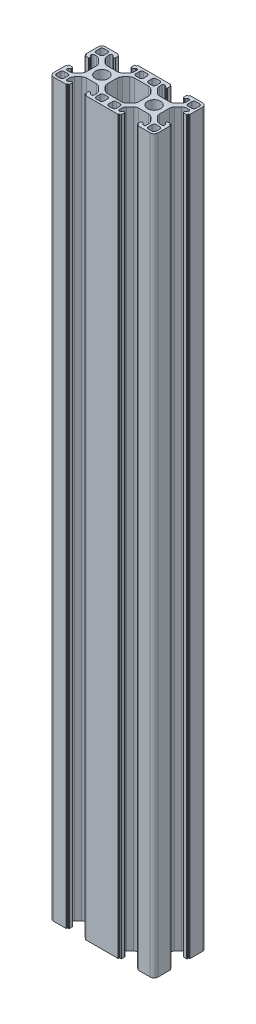
from build123d import *

# Parameters (mm, degrees)
EXTRUDE_1_DEPTH = 280


with BuildPart() as part:
    # Эскиз1 → Бобышка-Вытянуть1 (new body)
    with BuildSketch(Plane(origin=(0, 0, 0), x_dir=(1, 0, 0), z_dir=(0, 1, 0))):
        with BuildLine():
            Line((9.247825015, 4.683728486), (11.146605684, 4.683728486))
            ThreePointArc((11.146605684, 4.683728486), (11.911972549, 4.835969421), (12.560819246, 5.269514923))
            Line((12.560819246, 5.269514923), (13.862038577, 6.570734254))
            ThreePointArc((13.862038577, 6.570734254), (14.29558408, 7.219580952), (14.447825015, 7.984947817))
            Line((14.447825015, 7.984947817), (14.447825015, 8.883728486))
            ThreePointArc((14.447825015, 8.883728486), (14.301378405, 9.237281876), (13.947825015, 9.383728486))
            Line((13.947825015, 9.383728486), (13.844931796, 9.383728486))
            ThreePointArc((13.844931796, 9.383728486), (13.65359008, 9.345668252), (13.491378405, 9.237281876))
            Line((13.491378405, 9.237281876), (13.01104832, 8.75695179))
            ThreePointArc((13.01104832, 8.75695179), (12.929942482, 8.702758603), (12.834271624, 8.683728486))
            Line((12.834271624, 8.683728486), (12.547825015, 8.683728486))
            ThreePointArc((12.547825015, 8.683728486), (12.37104832, 8.75695179), (12.297825015, 8.933728486))
            Line((12.297825015, 8.933728486), (12.297825015, 10.082799306))
            ThreePointArc((12.297825015, 10.082799306), (12.341758998, 10.188865323), (12.447825015, 10.232799306))
            Line((12.447825015, 10.232799306), (12.947825015, 10.232799306))
            Line((12.947825015, 10.232799306), (12.947825015, 10.533728486))
            ThreePointArc((12.947825015, 10.533728486), (12.991758998, 10.639794503), (13.097825015, 10.683728486))
            Line((13.097825015, 10.683728486), (17.747825015, 10.683728486))
            ThreePointArc((17.747825015, 10.683728486), (18.808485187, 10.244388658), (19.247825015, 9.183728486))
            Line((19.247825015, 9.183728486), (19.247825015, 4.533728486))
            ThreePointArc((19.247825015, 4.533728486), (19.203891032, 4.427662469), (19.097825015, 4.383728486))
            Line((19.097825015, 4.383728486), (18.796895835, 4.383728486))
            Line((18.796895835, 4.383728486), (18.796895835, 3.883728486))
            ThreePointArc((18.796895835, 3.883728486), (18.752961853, 3.777662469), (18.646895835, 3.733728486))
            Line((18.646895835, 3.733728486), (17.497825015, 3.733728486))
            ThreePointArc((17.497825015, 3.733728486), (17.32104832, 3.80695179), (17.247825015, 3.983728486))
            Line((17.247825015, 3.983728486), (17.247825015, 4.270175095))
            ThreePointArc((17.247825015, 4.270175095), (17.266855132, 4.365845953), (17.32104832, 4.44695179))
            Line((17.32104832, 4.44695179), (17.801378405, 4.927281876))
            ThreePointArc((17.801378405, 4.927281876), (17.909764781, 5.089493551), (17.947825015, 5.280835267))
            Line((17.947825015, 5.280835267), (17.947825015, 5.383728486))
            ThreePointArc((17.947825015, 5.383728486), (17.801378405, 5.737281876), (17.447825015, 5.883728486))
            Line((17.447825015, 5.883728486), (16.549044346, 5.883728486))
            ThreePointArc((16.549044346, 5.883728486), (15.783677481, 5.731487551), (15.134830783, 5.297942048))
            Line((15.134830783, 5.297942048), (13.833611452, 3.996722717))
            ThreePointArc((13.833611452, 3.996722717), (13.40006595, 3.34787602), (13.247825015, 2.582509155))
            Line((13.247825015, 2.582509155), (13.247825015, 0.683728486))
            Line((13.247825015, 0.683728486), (13.247825015, -1.215052183))
            ThreePointArc((13.247825015, -1.215052183), (13.40006595, -1.980419048), (13.833611452, -2.629265746))
            Line((13.833611452, -2.629265746), (15.134830783, -3.930485077))
            ThreePointArc((15.134830783, -3.930485077), (15.783677481, -4.364030579), (16.549044346, -4.516271514))
            Line((16.549044346, -4.516271514), (17.447825015, -4.516271514))
            ThreePointArc((17.447825015, -4.516271514), (17.801378405, -4.369824905), (17.947825015, -4.016271514))
            Line((17.947825015, -4.016271514), (17.947825015, -3.913378295))
            ThreePointArc((17.947825015, -3.913378295), (17.909764781, -3.722036579), (17.801378405, -3.559824905))
            Line((17.801378405, -3.559824905), (17.32104832, -3.079494819))
            ThreePointArc((17.32104832, -3.079494819), (17.266855132, -2.998388982), (17.247825015, -2.902718124))
            Line((17.247825015, -2.902718124), (17.247825015, -2.616271514))
            ThreePointArc((17.247825015, -2.616271514), (17.32104832, -2.439494819), (17.497825015, -2.366271514))
            Line((17.497825015, -2.366271514), (18.646895835, -2.366271514))
            ThreePointArc((18.646895835, -2.366271514), (18.752961853, -2.410205497), (18.796895835, -2.516271514))
            Line((18.796895835, -2.516271514), (18.796895835, -3.016271514))
            Line((18.796895835, -3.016271514), (19.097825015, -3.016271514))
            ThreePointArc((19.097825015, -3.016271514), (19.203891032, -3.060205497), (19.247825015, -3.166271514))
            Line((19.247825015, -3.166271514), (19.247825015, -7.816271514))
            ThreePointArc((19.247825015, -7.816271514), (18.808485187, -8.876931686), (17.747825015, -9.316271514))
            Line((17.747825015, -9.316271514), (13.097825015, -9.316271514))
            ThreePointArc((13.097825015, -9.316271514), (12.991758998, -9.272337531), (12.947825015, -9.166271514))
            Line((12.947825015, -9.166271514), (12.947825015, -8.865342335))
            Line((12.947825015, -8.865342335), (12.447825015, -8.865342335))
            ThreePointArc((12.447825015, -8.865342335), (12.341758998, -8.821408352), (12.297825015, -8.715342335))
            Line((12.297825015, -8.715342335), (12.297825015, -7.566271514))
            ThreePointArc((12.297825015, -7.566271514), (12.37104832, -7.389494819), (12.547825015, -7.316271514))
            Line((12.547825015, -7.316271514), (12.834271624, -7.316271514))
            ThreePointArc((12.834271624, -7.316271514), (12.929942482, -7.335301631), (13.01104832, -7.389494819))
            Line((13.01104832, -7.389494819), (13.491378405, -7.869824905))
            ThreePointArc((13.491378405, -7.869824905), (13.65359008, -7.978211281), (13.844931796, -8.016271514))
            Line((13.844931796, -8.016271514), (13.947825015, -8.016271514))
            ThreePointArc((13.947825015, -8.016271514), (14.301378405, -7.869824905), (14.447825015, -7.516271514))
            Line((14.447825015, -7.516271514), (14.447825015, -6.617490845))
            ThreePointArc((14.447825015, -6.617490845), (14.29558408, -5.85212398), (13.862038577, -5.203277283))
            Line((13.862038577, -5.203277283), (12.560819246, -3.902057952))
            ThreePointArc((12.560819246, -3.902057952), (11.911972549, -3.468512449), (11.146605684, -3.316271514))
            Line((11.146605684, -3.316271514), (9.247825015, -3.316271514))
            Line((9.247825015, -3.316271514), (7.349044346, -3.316271514))
            ThreePointArc((7.349044346, -3.316271514), (6.583677481, -3.468512449), (5.934830783, -3.902057952))
            Line((5.934830783, -3.902057952), (4.633611452, -5.203277283))
            ThreePointArc((4.633611452, -5.203277283), (4.20006595, -5.85212398), (4.047825015, -6.617490845))
            Line((4.047825015, -6.617490845), (4.047825015, -7.516271514))
            ThreePointArc((4.047825015, -7.516271514), (4.194271624, -7.869824905), (4.547825015, -8.016271514))
            Line((4.547825015, -8.016271514), (4.650718234, -8.016271514))
            ThreePointArc((4.650718234, -8.016271514), (4.84205995, -7.978211281), (5.004271624, -7.869824905))
            Line((5.004271624, -7.869824905), (5.48460171, -7.389494819))
            ThreePointArc((5.48460171, -7.389494819), (5.565707547, -7.335301631), (5.661378405, -7.316271514))
            Line((5.661378405, -7.316271514), (5.947825015, -7.316271514))
            ThreePointArc((5.947825015, -7.316271514), (6.12460171, -7.389494819), (6.197825015, -7.566271514))
            Line((6.197825015, -7.566271514), (6.197825015, -8.715342335))
            ThreePointArc((6.197825015, -8.715342335), (6.153891032, -8.821408352), (6.047825015, -8.865342335))
            Line((6.047825015, -8.865342335), (5.547825015, -8.865342335))
            Line((5.547825015, -8.865342335), (5.547825015, -9.166271514))
            ThreePointArc((5.547825015, -9.166271514), (5.503891032, -9.272337531), (5.397825015, -9.316271514))
            Line((5.397825015, -9.316271514), (0.747825015, -9.316271514))
            Line((0.747825015, -9.316271514), (-2.252174985, -9.316271514))
            Line((-2.252174985, -9.316271514), (-6.902174985, -9.316271514))
            ThreePointArc((-6.902174985, -9.316271514), (-7.008241002, -9.272337531), (-7.052174985, -9.166271514))
            Line((-7.052174985, -9.166271514), (-7.052174985, -8.865342335))
            Line((-7.052174985, -8.865342335), (-7.552174985, -8.865342335))
            ThreePointArc((-7.552174985, -8.865342335), (-7.658241002, -8.821408352), (-7.702174985, -8.715342335))
            Line((-7.702174985, -8.715342335), (-7.702174985, -7.566271514))
            ThreePointArc((-7.702174985, -7.566271514), (-7.62895168, -7.389494819), (-7.452174985, -7.316271514))
            Line((-7.452174985, -7.316271514), (-7.165728376, -7.316271514))
            ThreePointArc((-7.165728376, -7.316271514), (-7.070057518, -7.335301631), (-6.98895168, -7.389494819))
            Line((-6.98895168, -7.389494819), (-6.508621595, -7.869824905))
            ThreePointArc((-6.508621595, -7.869824905), (-6.34640992, -7.978211281), (-6.155068204, -8.016271514))
            Line((-6.155068204, -8.016271514), (-6.052174985, -8.016271514))
            ThreePointArc((-6.052174985, -8.016271514), (-5.698621595, -7.869824905), (-5.552174985, -7.516271514))
            Line((-5.552174985, -7.516271514), (-5.552174985, -6.617490845))
            ThreePointArc((-5.552174985, -6.617490845), (-5.70441592, -5.85212398), (-6.137961423, -5.203277283))
            Line((-6.137961423, -5.203277283), (-7.439180754, -3.902057952))
            ThreePointArc((-7.439180754, -3.902057952), (-8.088027451, -3.468512449), (-8.853394316, -3.316271514))
            Line((-8.853394316, -3.316271514), (-10.752174985, -3.316271514))
            Line((-10.752174985, -3.316271514), (-12.650955654, -3.316271514))
            ThreePointArc((-12.650955654, -3.316271514), (-13.416322519, -3.468512449), (-14.065169217, -3.902057952))
            Line((-14.065169217, -3.902057952), (-15.366388548, -5.203277283))
            ThreePointArc((-15.366388548, -5.203277283), (-15.79993405, -5.85212398), (-15.952174985, -6.617490845))
            Line((-15.952174985, -6.617490845), (-15.952174985, -7.516271514))
            ThreePointArc((-15.952174985, -7.516271514), (-15.805728376, -7.869824905), (-15.452174985, -8.016271514))
            Line((-15.452174985, -8.016271514), (-15.349281766, -8.016271514))
            ThreePointArc((-15.349281766, -8.016271514), (-15.15794005, -7.978211281), (-14.995728376, -7.869824905))
            Line((-14.995728376, -7.869824905), (-14.51539829, -7.389494819))
            ThreePointArc((-14.51539829, -7.389494819), (-14.434292453, -7.335301631), (-14.338621595, -7.316271514))
            Line((-14.338621595, -7.316271514), (-14.052174985, -7.316271514))
            ThreePointArc((-14.052174985, -7.316271514), (-13.87539829, -7.389494819), (-13.802174985, -7.566271514))
            Line((-13.802174985, -7.566271514), (-13.802174985, -8.715342335))
            ThreePointArc((-13.802174985, -8.715342335), (-13.846108968, -8.821408352), (-13.952174985, -8.865342335))
            Line((-13.952174985, -8.865342335), (-14.452174985, -8.865342335))
            Line((-14.452174985, -8.865342335), (-14.452174985, -9.166271514))
            ThreePointArc((-14.452174985, -9.166271514), (-14.496108968, -9.272337531), (-14.602174985, -9.316271514))
            Line((-14.602174985, -9.316271514), (-19.252174985, -9.316271514))
            ThreePointArc((-19.252174985, -9.316271514), (-20.312835157, -8.876931686), (-20.752174985, -7.816271514))
            Line((-20.752174985, -7.816271514), (-20.752174985, -3.166271514))
            ThreePointArc((-20.752174985, -3.166271514), (-20.708241002, -3.060205497), (-20.602174985, -3.016271514))
            Line((-20.602174985, -3.016271514), (-20.301245806, -3.016271514))
            Line((-20.301245806, -3.016271514), (-20.301245806, -2.516271514))
            ThreePointArc((-20.301245806, -2.516271514), (-20.257311823, -2.410205497), (-20.151245806, -2.366271514))
            Line((-20.151245806, -2.366271514), (-19.002174985, -2.366271514))
            ThreePointArc((-19.002174985, -2.366271514), (-18.82539829, -2.439494819), (-18.752174985, -2.616271514))
            Line((-18.752174985, -2.616271514), (-18.752174985, -2.902718124))
            ThreePointArc((-18.752174985, -2.902718124), (-18.771205102, -2.998388982), (-18.82539829, -3.079494819))
            Line((-18.82539829, -3.079494819), (-19.305728376, -3.559824905))
            ThreePointArc((-19.305728376, -3.559824905), (-19.414114751, -3.722036579), (-19.452174985, -3.913378295))
            Line((-19.452174985, -3.913378295), (-19.452174985, -4.016271514))
            ThreePointArc((-19.452174985, -4.016271514), (-19.305728376, -4.369824905), (-18.952174985, -4.516271514))
            Line((-18.952174985, -4.516271514), (-18.053394316, -4.516271514))
            ThreePointArc((-18.053394316, -4.516271514), (-17.288027451, -4.364030579), (-16.639180754, -3.930485077))
            Line((-16.639180754, -3.930485077), (-15.337961423, -2.629265746))
            ThreePointArc((-15.337961423, -2.629265746), (-14.90441592, -1.980419048), (-14.752174985, -1.215052183))
            Line((-14.752174985, -1.215052183), (-14.752174985, 0.683728486))
            Line((-14.752174985, 0.683728486), (-14.752174985, 2.582509155))
            ThreePointArc((-14.752174985, 2.582509155), (-14.90441592, 3.34787602), (-15.337961423, 3.996722717))
            Line((-15.337961423, 3.996722717), (-16.639180754, 5.297942048))
            ThreePointArc((-16.639180754, 5.297942048), (-17.288027451, 5.731487551), (-18.053394316, 5.883728486))
            Line((-18.053394316, 5.883728486), (-18.952174985, 5.883728486))
            ThreePointArc((-18.952174985, 5.883728486), (-19.305728376, 5.737281876), (-19.452174985, 5.383728486))
            Line((-19.452174985, 5.383728486), (-19.452174985, 5.280835267))
            ThreePointArc((-19.452174985, 5.280835267), (-19.414114751, 5.089493551), (-19.305728376, 4.927281876))
            Line((-19.305728376, 4.927281876), (-18.82539829, 4.44695179))
            ThreePointArc((-18.82539829, 4.44695179), (-18.771205102, 4.365845953), (-18.752174985, 4.270175095))
            Line((-18.752174985, 4.270175095), (-18.752174985, 3.983728486))
            ThreePointArc((-18.752174985, 3.983728486), (-18.82539829, 3.80695179), (-19.002174985, 3.733728486))
            Line((-19.002174985, 3.733728486), (-20.151245806, 3.733728486))
            ThreePointArc((-20.151245806, 3.733728486), (-20.257311823, 3.777662469), (-20.301245806, 3.883728486))
            Line((-20.301245806, 3.883728486), (-20.301245806, 4.383728486))
            Line((-20.301245806, 4.383728486), (-20.602174985, 4.383728486))
            ThreePointArc((-20.602174985, 4.383728486), (-20.708241002, 4.427662469), (-20.752174985, 4.533728486))
            Line((-20.752174985, 4.533728486), (-20.752174985, 9.183728486))
            ThreePointArc((-20.752174985, 9.183728486), (-20.312835157, 10.244388658), (-19.252174985, 10.683728486))
            Line((-19.252174985, 10.683728486), (-14.602174985, 10.683728486))
            ThreePointArc((-14.602174985, 10.683728486), (-14.496108968, 10.639794503), (-14.452174985, 10.533728486))
            Line((-14.452174985, 10.533728486), (-14.452174985, 10.232799306))
            Line((-14.452174985, 10.232799306), (-13.952174985, 10.232799306))
            ThreePointArc((-13.952174985, 10.232799306), (-13.846108968, 10.188865323), (-13.802174985, 10.082799306))
            Line((-13.802174985, 10.082799306), (-13.802174985, 8.933728486))
            ThreePointArc((-13.802174985, 8.933728486), (-13.87539829, 8.75695179), (-14.052174985, 8.683728486))
            Line((-14.052174985, 8.683728486), (-14.338621595, 8.683728486))
            ThreePointArc((-14.338621595, 8.683728486), (-14.434292453, 8.702758603), (-14.51539829, 8.75695179))
            Line((-14.51539829, 8.75695179), (-14.995728376, 9.237281876))
            ThreePointArc((-14.995728376, 9.237281876), (-15.15794005, 9.345668252), (-15.349281766, 9.383728486))
            Line((-15.349281766, 9.383728486), (-15.452174985, 9.383728486))
            ThreePointArc((-15.452174985, 9.383728486), (-15.805728376, 9.237281876), (-15.952174985, 8.883728486))
            Line((-15.952174985, 8.883728486), (-15.952174985, 7.984947817))
            ThreePointArc((-15.952174985, 7.984947817), (-15.79993405, 7.219580952), (-15.366388548, 6.570734254))
            Line((-15.366388548, 6.570734254), (-14.065169217, 5.269514923))
            ThreePointArc((-14.065169217, 5.269514923), (-13.416322519, 4.835969421), (-12.650955654, 4.683728486))
            Line((-12.650955654, 4.683728486), (-10.752174985, 4.683728486))
            Line((-10.752174985, 4.683728486), (-8.853394316, 4.683728486))
            ThreePointArc((-8.853394316, 4.683728486), (-8.088027451, 4.835969421), (-7.439180754, 5.269514923))
            Line((-7.439180754, 5.269514923), (-6.137961423, 6.570734254))
            ThreePointArc((-6.137961423, 6.570734254), (-5.70441592, 7.219580952), (-5.552174985, 7.984947817))
            Line((-5.552174985, 7.984947817), (-5.552174985, 8.883728486))
            ThreePointArc((-5.552174985, 8.883728486), (-5.698621595, 9.237281876), (-6.052174985, 9.383728486))
            Line((-6.052174985, 9.383728486), (-6.155068204, 9.383728486))
            ThreePointArc((-6.155068204, 9.383728486), (-6.34640992, 9.345668252), (-6.508621595, 9.237281876))
            Line((-6.508621595, 9.237281876), (-6.98895168, 8.75695179))
            ThreePointArc((-6.98895168, 8.75695179), (-7.070057518, 8.702758603), (-7.165728376, 8.683728486))
            Line((-7.165728376, 8.683728486), (-7.452174985, 8.683728486))
            ThreePointArc((-7.452174985, 8.683728486), (-7.62895168, 8.75695179), (-7.702174985, 8.933728486))
            Line((-7.702174985, 8.933728486), (-7.702174985, 10.082799306))
            ThreePointArc((-7.702174985, 10.082799306), (-7.658241002, 10.188865323), (-7.552174985, 10.232799306))
            Line((-7.552174985, 10.232799306), (-7.052174985, 10.232799306))
            Line((-7.052174985, 10.232799306), (-7.052174985, 10.533728486))
            ThreePointArc((-7.052174985, 10.533728486), (-7.008241002, 10.639794503), (-6.902174985, 10.683728486))
            Line((-6.902174985, 10.683728486), (-2.252174985, 10.683728486))
            Line((-2.252174985, 10.683728486), (0.747825015, 10.683728486))
            Line((0.747825015, 10.683728486), (5.397825015, 10.683728486))
            ThreePointArc((5.397825015, 10.683728486), (5.503891032, 10.639794503), (5.547825015, 10.533728486))
            Line((5.547825015, 10.533728486), (5.547825015, 10.232799306))
            Line((5.547825015, 10.232799306), (6.047825015, 10.232799306))
            ThreePointArc((6.047825015, 10.232799306), (6.153891032, 10.188865323), (6.197825015, 10.082799306))
            Line((6.197825015, 10.082799306), (6.197825015, 8.933728486))
            ThreePointArc((6.197825015, 8.933728486), (6.12460171, 8.75695179), (5.947825015, 8.683728486))
            Line((5.947825015, 8.683728486), (5.661378405, 8.683728486))
            ThreePointArc((5.661378405, 8.683728486), (5.565707547, 8.702758603), (5.48460171, 8.75695179))
            Line((5.48460171, 8.75695179), (5.004271624, 9.237281876))
            ThreePointArc((5.004271624, 9.237281876), (4.84205995, 9.345668252), (4.650718234, 9.383728486))
            Line((4.650718234, 9.383728486), (4.547825015, 9.383728486))
            ThreePointArc((4.547825015, 9.383728486), (4.194271624, 9.237281876), (4.047825015, 8.883728486))
            Line((4.047825015, 8.883728486), (4.047825015, 7.984947817))
            ThreePointArc((4.047825015, 7.984947817), (4.20006595, 7.219580952), (4.633611452, 6.570734254))
            Line((4.633611452, 6.570734254), (5.934830783, 5.269514923))
            ThreePointArc((5.934830783, 5.269514923), (6.583677481, 4.835969421), (7.349044346, 4.683728486))
            Line((7.349044346, 4.683728486), (9.247825015, 4.683728486))
        make_face()
        with BuildLine():
            Line((16.147825015, 6.783728486), (17.547825015, 6.783728486))
            ThreePointArc((17.547825015, 6.783728486), (18.11351044, 7.018043061), (18.347825015, 7.583728486))
            Line((18.347825015, 7.583728486), (18.347825015, 8.983728486))
            ThreePointArc((18.347825015, 8.983728486), (18.11351044, 9.549413911), (17.547825015, 9.783728486))
            Line((17.547825015, 9.783728486), (16.147825015, 9.783728486))
            ThreePointArc((16.147825015, 9.783728486), (15.58213959, 9.549413911), (15.347825015, 8.983728486))
            Line((15.347825015, 8.983728486), (15.347825015, 7.583728486))
            ThreePointArc((15.347825015, 7.583728486), (15.58213959, 7.018043061), (16.147825015, 6.783728486))
        make_face(mode=Mode.SUBTRACT)
        with BuildLine():
            Line((15.347825015, -6.216271514), (15.347825015, -7.616271514))
            ThreePointArc((15.347825015, -7.616271514), (15.58213959, -8.181956939), (16.147825015, -8.416271514))
            Line((16.147825015, -8.416271514), (17.547825015, -8.416271514))
            ThreePointArc((17.547825015, -8.416271514), (18.11351044, -8.181956939), (18.347825015, -7.616271514))
            Line((18.347825015, -7.616271514), (18.347825015, -6.216271514))
            ThreePointArc((18.347825015, -6.216271514), (18.11351044, -5.650586089), (17.547825015, -5.416271514))
            Line((17.547825015, -5.416271514), (16.147825015, -5.416271514))
            ThreePointArc((16.147825015, -5.416271514), (15.58213959, -5.650586089), (15.347825015, -6.216271514))
        make_face(mode=Mode.SUBTRACT)
        with BuildLine():
            Line((2.347825015, -5.416271514), (0.947825015, -5.416271514))
            ThreePointArc((0.947825015, -5.416271514), (0.38213959, -5.650586089), (0.147825015, -6.216271514))
            Line((0.147825015, -6.216271514), (0.147825015, -7.616271514))
            ThreePointArc((0.147825015, -7.616271514), (0.38213959, -8.181956939), (0.947825015, -8.416271514))
            Line((0.947825015, -8.416271514), (2.347825015, -8.416271514))
            ThreePointArc((2.347825015, -8.416271514), (2.91351044, -8.181956939), (3.147825015, -7.616271514))
            Line((3.147825015, -7.616271514), (3.147825015, -6.216271514))
            ThreePointArc((3.147825015, -6.216271514), (2.91351044, -5.650586089), (2.347825015, -5.416271514))
        make_face(mode=Mode.SUBTRACT)
        with BuildLine():
            Line((1.047825015, -4.516271514), (1.946605684, -4.516271514))
            ThreePointArc((1.946605684, -4.516271514), (2.711972549, -4.364030579), (3.360819246, -3.930485077))
            Line((3.360819246, -3.930485077), (4.662038577, -2.629265746))
            ThreePointArc((4.662038577, -2.629265746), (5.09558408, -1.980419048), (5.247825015, -1.215052183))
            Line((5.247825015, -1.215052183), (5.247825015, 0.683728486))
            Line((5.247825015, 0.683728486), (5.247825015, 2.582509155))
            ThreePointArc((5.247825015, 2.582509155), (5.09558408, 3.34787602), (4.662038577, 3.996722717))
            Line((4.662038577, 3.996722717), (3.360819246, 5.297942048))
            ThreePointArc((3.360819246, 5.297942048), (2.711972549, 5.731487551), (1.946605684, 5.883728486))
            Line((1.946605684, 5.883728486), (1.047825015, 5.883728486))
            Line((1.047825015, 5.883728486), (-2.552174985, 5.883728486))
            Line((-2.552174985, 5.883728486), (-3.450955654, 5.883728486))
            ThreePointArc((-3.450955654, 5.883728486), (-4.216322519, 5.731487551), (-4.865169217, 5.297942048))
            Line((-4.865169217, 5.297942048), (-6.166388548, 3.996722717))
            ThreePointArc((-6.166388548, 3.996722717), (-6.59993405, 3.34787602), (-6.752174985, 2.582509155))
            Line((-6.752174985, 2.582509155), (-6.752174985, 0.683728486))
            Line((-6.752174985, 0.683728486), (-6.752174985, -1.215052183))
            ThreePointArc((-6.752174985, -1.215052183), (-6.59993405, -1.980419048), (-6.166388548, -2.629265746))
            Line((-6.166388548, -2.629265746), (-4.865169217, -3.930485077))
            ThreePointArc((-4.865169217, -3.930485077), (-4.216322519, -4.364030579), (-3.450955654, -4.516271514))
            Line((-3.450955654, -4.516271514), (-2.552174985, -4.516271514))
            Line((-2.552174985, -4.516271514), (1.047825015, -4.516271514))
        make_face(mode=Mode.SUBTRACT)
        with BuildLine():
            Line((3.147825015, 7.583728486), (3.147825015, 8.983728486))
            ThreePointArc((3.147825015, 8.983728486), (2.91351044, 9.549413911), (2.347825015, 9.783728486))
            Line((2.347825015, 9.783728486), (0.947825015, 9.783728486))
            ThreePointArc((0.947825015, 9.783728486), (0.38213959, 9.549413911), (0.147825015, 8.983728486))
            Line((0.147825015, 8.983728486), (0.147825015, 7.583728486))
            ThreePointArc((0.147825015, 7.583728486), (0.38213959, 7.018043061), (0.947825015, 6.783728486))
            Line((0.947825015, 6.783728486), (2.347825015, 6.783728486))
            ThreePointArc((2.347825015, 6.783728486), (2.91351044, 7.018043061), (3.147825015, 7.583728486))
        make_face(mode=Mode.SUBTRACT)
        with BuildLine():
            Line((-2.452174985, 9.783728486), (-3.852174985, 9.783728486))
            ThreePointArc((-3.852174985, 9.783728486), (-4.41786041, 9.549413911), (-4.652174985, 8.983728486))
            Line((-4.652174985, 8.983728486), (-4.652174985, 7.583728486))
            ThreePointArc((-4.652174985, 7.583728486), (-4.41786041, 7.018043061), (-3.852174985, 6.783728486))
            Line((-3.852174985, 6.783728486), (-2.452174985, 6.783728486))
            ThreePointArc((-2.452174985, 6.783728486), (-1.88648956, 7.018043061), (-1.652174985, 7.583728486))
            Line((-1.652174985, 7.583728486), (-1.652174985, 8.983728486))
            ThreePointArc((-1.652174985, 8.983728486), (-1.88648956, 9.549413911), (-2.452174985, 9.783728486))
        make_face(mode=Mode.SUBTRACT)
        with BuildLine():
            Line((-1.652174985, -7.616271514), (-1.652174985, -6.216271514))
            ThreePointArc((-1.652174985, -6.216271514), (-1.88648956, -5.650586089), (-2.452174985, -5.416271514))
            Line((-2.452174985, -5.416271514), (-3.852174985, -5.416271514))
            ThreePointArc((-3.852174985, -5.416271514), (-4.41786041, -5.650586089), (-4.652174985, -6.216271514))
            Line((-4.652174985, -6.216271514), (-4.652174985, -7.616271514))
            ThreePointArc((-4.652174985, -7.616271514), (-4.41786041, -8.181956939), (-3.852174985, -8.416271514))
            Line((-3.852174985, -8.416271514), (-2.452174985, -8.416271514))
            ThreePointArc((-2.452174985, -8.416271514), (-1.88648956, -8.181956939), (-1.652174985, -7.616271514))
        make_face(mode=Mode.SUBTRACT)
        with BuildLine():
            Line((-19.052174985, -8.416271514), (-17.652174985, -8.416271514))
            ThreePointArc((-17.652174985, -8.416271514), (-17.08648956, -8.181956939), (-16.852174985, -7.616271514))
            Line((-16.852174985, -7.616271514), (-16.852174985, -6.216271514))
            ThreePointArc((-16.852174985, -6.216271514), (-17.08648956, -5.650586089), (-17.652174985, -5.416271514))
            Line((-17.652174985, -5.416271514), (-19.052174985, -5.416271514))
            ThreePointArc((-19.052174985, -5.416271514), (-19.61786041, -5.650586089), (-19.852174985, -6.216271514))
            Line((-19.852174985, -6.216271514), (-19.852174985, -7.616271514))
            ThreePointArc((-19.852174985, -7.616271514), (-19.61786041, -8.181956939), (-19.052174985, -8.416271514))
        make_face(mode=Mode.SUBTRACT)
        with BuildLine():
            Line((-19.852174985, 8.983728486), (-19.852174985, 7.583728486))
            ThreePointArc((-19.852174985, 7.583728486), (-19.61786041, 7.018043061), (-19.052174985, 6.783728486))
            Line((-19.052174985, 6.783728486), (-17.652174985, 6.783728486))
            ThreePointArc((-17.652174985, 6.783728486), (-17.08648956, 7.018043061), (-16.852174985, 7.583728486))
            Line((-16.852174985, 7.583728486), (-16.852174985, 8.983728486))
            ThreePointArc((-16.852174985, 8.983728486), (-17.08648956, 9.549413911), (-17.652174985, 9.783728486))
            Line((-17.652174985, 9.783728486), (-19.052174985, 9.783728486))
            ThreePointArc((-19.052174985, 9.783728486), (-19.61786041, 9.549413911), (-19.852174985, 8.983728486))
        make_face(mode=Mode.SUBTRACT)
        with BuildLine():
            ThreePointArc((11.747825015, 0.683728486), (11.015591968, 2.451495439), (9.247825015, 3.183728486))
            ThreePointArc((9.247825015, 3.183728486), (7.480058062, 2.451495439), (6.747825015, 0.683728486))
            ThreePointArc((6.747825015, 0.683728486), (7.480058062, -1.084038467), (9.247825015, -1.816271514))
            ThreePointArc((9.247825015, -1.816271514), (11.015591968, -1.084038467), (11.747825015, 0.683728486))
        make_face(mode=Mode.SUBTRACT)
        with BuildLine():
            ThreePointArc((-10.752174985, 3.183728486), (-8.984408032, 2.451495439), (-8.252174985, 0.683728486))
            ThreePointArc((-8.252174985, 0.683728486), (-8.984408032, -1.084038467), (-10.752174985, -1.816271514))
            ThreePointArc((-10.752174985, -1.816271514), (-12.519941938, -1.084038467), (-13.252174985, 0.683728486))
            ThreePointArc((-13.252174985, 0.683728486), (-12.519941938, 2.451495439), (-10.752174985, 3.183728486))
        make_face(mode=Mode.SUBTRACT)
    extrude(amount=EXTRUDE_1_DEPTH)


solid = part.part
